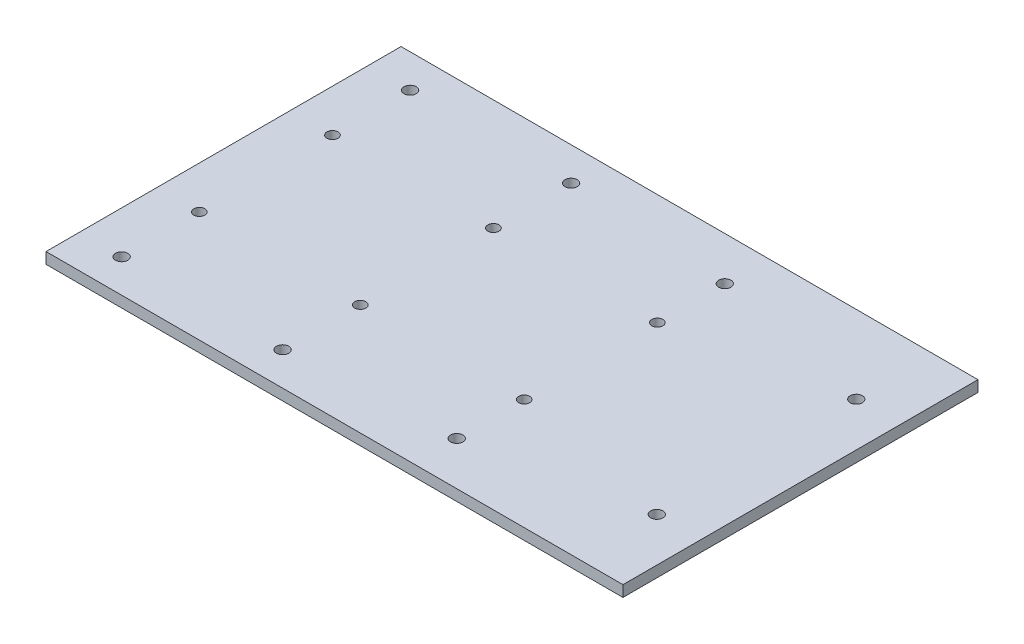
from build123d import *

# Parameters (mm, degrees)
SKETCH1_W                      = 330.2
SKETCH1_H                      = 203.2
BOSS_EXTRUDE1_DEPTH            = 6.35
F_1_4_0_25_PRESS_DOWEL_HOLE1_D = 6.35
M8X1_0_TAPPED_HOLE1_D          = 7


with BuildPart() as part:
    # Sketch1 → Boss-Extrude1 (new body)
    with BuildSketch(Plane(origin=(0, 0, 0), x_dir=(1, 0, 0), z_dir=(0, 1, 0))):
        Rectangle(SKETCH1_W, SKETCH1_H)
    extrude(amount=BOSS_EXTRUDE1_DEPTH)

    # 1/4 (0.25) Press Dowel Hole1 (through all)
    with Locations(Plane(origin=(0, 6.35, 0), x_dir=(1, 0, 0), z_dir=(0, 1, 0))):
        with Locations((-140.85176751, 38.099999999), (-140.851357678, -38.099999999), (-48.715925188, -38.099504462), (-48.715925188, 38.100495539), (45.083869896, 38.101000028), (45.084279728, -38.098999971)):
            Hole(F_1_4_0_25_PRESS_DOWEL_HOLE1_D / 2)

    # M8x1.0 Tapped Hole1 (through all)
    with Locations(Plane(origin=(0, 6.35, 0), x_dir=(1, 0, 0), z_dir=(0, 1, 0))):
        with Locations((-140.851562594, 82.55), (-48.715925188, 82.55), (45.084074812, 76.701000029), (45.084074812, -76.698999971), (-48.715925188, -82.55), (-140.851562594, -82.55), (139.954074812, 57.072042721), (139.954074812, -57.072042721)):
            Hole(M8X1_0_TAPPED_HOLE1_D / 2)


solid = part.part
